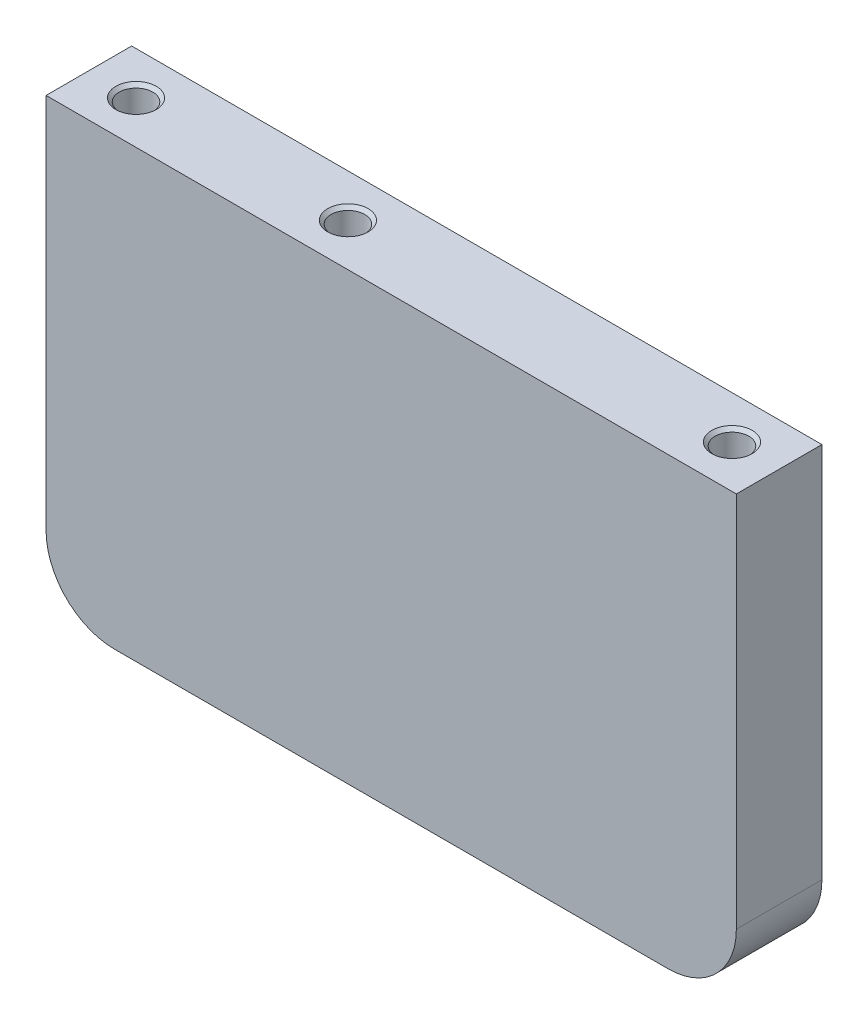
from build123d import *

# Parameters (mm, degrees)
SKETCH1_W           = 51.225
SKETCH1_H           = 33.05
BOSS_EXTRUDE1_DEPTH = 6.35
SKETCH8_R           = 1.25
CUT_EXTRUDE4_DEPTH  = 15
FILLET3_R           = 5.08
SKETCH10_R          = 3.35
SKETCH10_R_2        = 11.05
CUT_EXTRUDE5_DEPTH  = 4.7625
CHAMFER1_SIZE       = 0.25


with BuildPart() as part:
    # Sketch1 → Boss-Extrude1 (new body)
    with BuildSketch(Plane.XY):
        with Locations((-7.6125, 2.525)):
            Rectangle(SKETCH1_W, SKETCH1_H)
    extrude(amount=-BOSS_EXTRUDE1_DEPTH)

    # Sketch8 → Cut-Extrude4 (cut)
    with BuildSketch(Plane(origin=(0, 19.05, 0), x_dir=(1, 0, 0), z_dir=(0, 1, 0))):
        with Locations(Location((-29.725, 3.175, 0), (0, 0, 270))):
            Circle(SKETCH8_R)
        with Locations(Location((-14, 3.175, 0), (0, 0, 270))):
            Circle(SKETCH8_R)
        with Locations(Location((14.5, 3.175, 0), (0, 0, 270))):
            Circle(SKETCH8_R)
    extrude(amount=-CUT_EXTRUDE4_DEPTH, mode=Mode.SUBTRACT)

    # Fillet3
    fillet3_edges = [part.edges().sort_by_distance(p)[0] for p in [
        (18, -14, -3.175),
        (-33.225, -14, -3.175),
    ]]
    fillet(fillet3_edges, radius=FILLET3_R)

    # Sketch10 → Cut-Extrude5 (cut)
    with BuildSketch(Plane(origin=(0, 0, -6.35), x_dir=(-1, 0, 0), z_dir=(0, 0, -1))):
        with Locations((22.225, 0)):
            Circle(SKETCH10_R)
        Circle(SKETCH10_R_2)
    extrude(amount=-CUT_EXTRUDE5_DEPTH, mode=Mode.SUBTRACT)

    # Chamfer1
    chamfer1_edges = [part.edges().sort_by_distance(p)[0] for p in [
        (-29.725, 19.05, -4.425),
        (-14, 19.05, -4.425),
        (14.5, 19.05, -4.425),
    ]]
    chamfer(chamfer1_edges, length=CHAMFER1_SIZE)


solid = part.part
